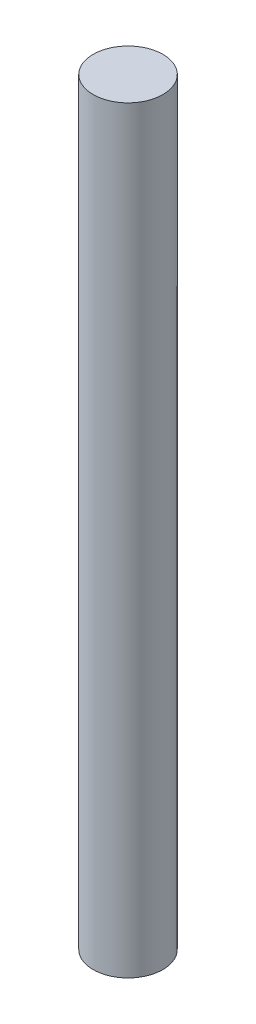
from build123d import *

# Parameters (mm, degrees)
SKETCH1_R           = 1.7526
BOSS_EXTRUDE1_DEPTH = 38.1


with BuildPart() as part:
    # Sketch1 → Boss-Extrude1 (new body)
    with BuildSketch(Plane(origin=(0, 0, 0), x_dir=(1, 0, 0), z_dir=(0, 1, 0))):
        with Locations(Location((0, 0, 0), (0, 0, 90))):
            Circle(SKETCH1_R)
    extrude(amount=BOSS_EXTRUDE1_DEPTH)


solid = part.part
